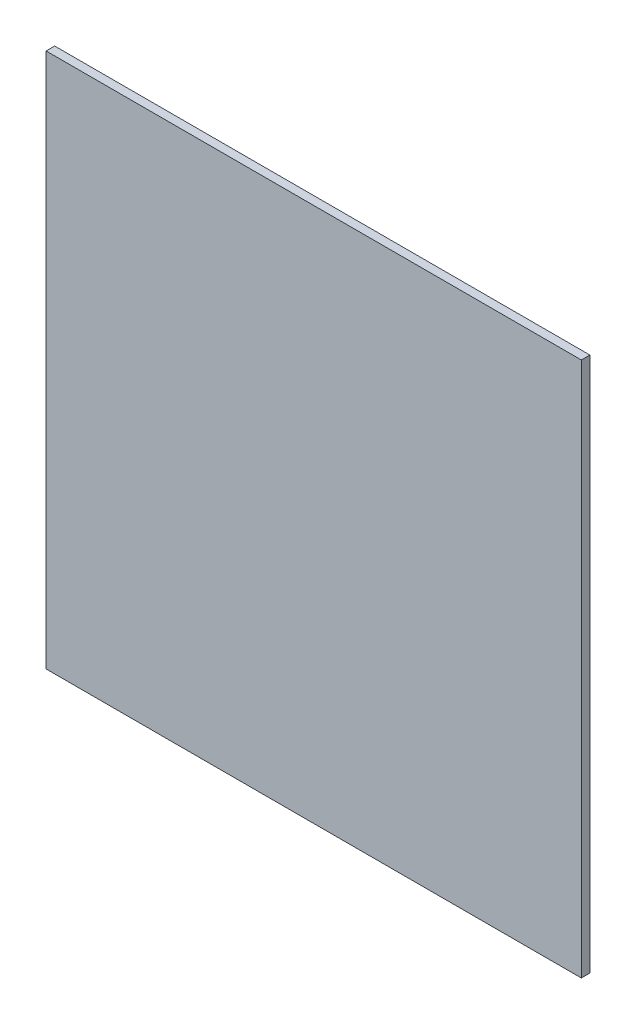
from build123d import *

# Parameters (mm, degrees)
SKETCH_1_W      = 125
SKETCH_1_H      = 125
EXTRUDE_1_DEPTH = 2


with BuildPart() as part:
    # Эскиз1 → Бобышка-Вытянуть1 (new body)
    with BuildSketch(Plane.XY):
        Rectangle(SKETCH_1_W, SKETCH_1_H)
    extrude(amount=EXTRUDE_1_DEPTH)


solid = part.part
